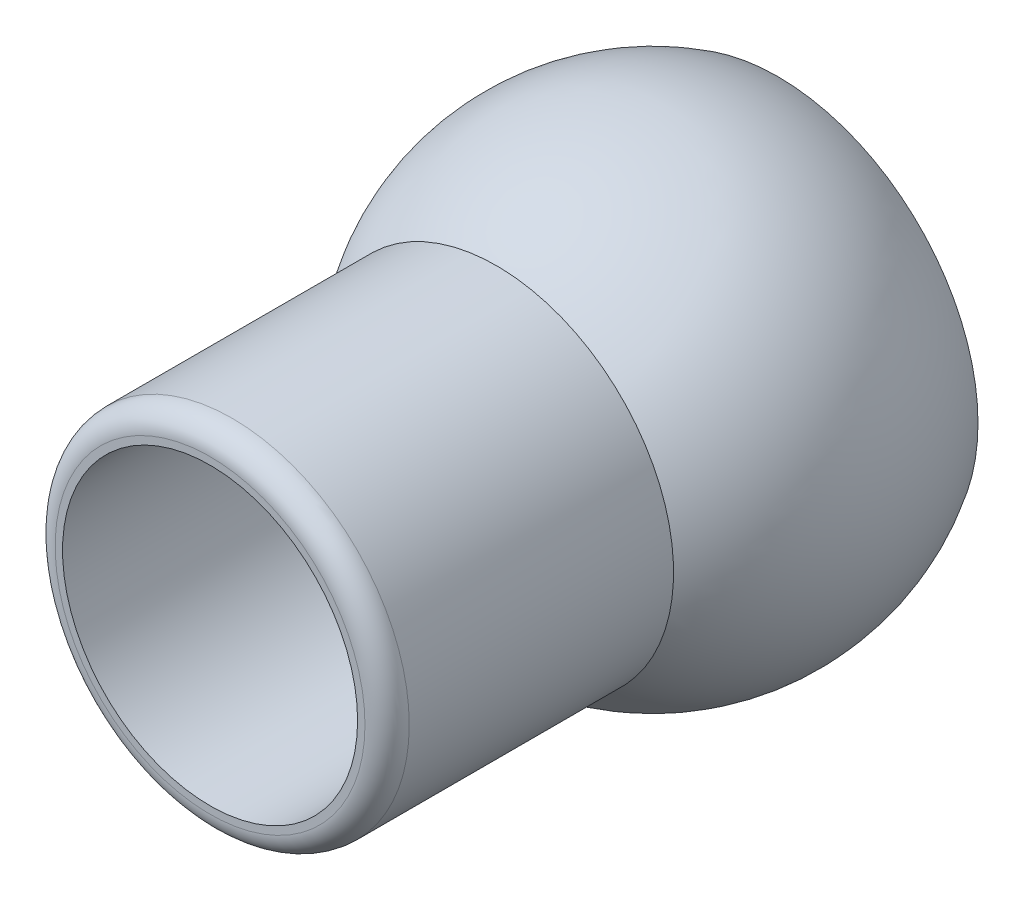
from build123d import *

# Parameters (mm, degrees)
SKETCH_3_R               = 12
EXTRUDE_2_DEPTH          = 30
CUT_EXTRUDE_2_DEPTH      = 30
CUT_EXTRUDE_2_DEPTH_BACK = 23
SKETCH_4_R               = 10
FILLET_1_R               = 1.5
CUT_EXTRUDE_3_DEPTH      = 20
CUT_EXTRUDE_3_DEPTH_BACK = 20
SKETCH_8_W               = 4
SKETCH_8_H               = 28.277196464
FILLET_2_R               = 1


with BuildPart() as part:
    # 草图1 → 旋转1 (revolve)
    with BuildSketch(Plane.XY):
        with BuildLine():
            Line((0, 16), (0, -16))
            ThreePointArc((0, -16), (16, 0), (0, 16))
        make_face()
    revolve(axis=Axis((0, 16, 0), (0, -1, 0)))

    # 草图2 → 切除-旋转1 (revolve, cut)
    with BuildSketch(Plane.XY):
        with BuildLine():
            Line((0, 14), (0, -14))
            ThreePointArc((0, -14), (14, 0), (0, 14))
        make_face()
    revolve(axis=Axis((0, 14, 0), (0, -1, 0)), mode=Mode.SUBTRACT)

    # 草图3 → 凸台-拉伸2 (add)
    with BuildSketch(Plane.XY):
        Circle(SKETCH_3_R)
    extrude(amount=EXTRUDE_2_DEPTH)

    # 草图4 → 切除-拉伸2 (cut, two sides: drawn at the far end of the back side and taken through both)
    with BuildSketch(Plane.XY.offset(-CUT_EXTRUDE_2_DEPTH_BACK)):
        Circle(SKETCH_4_R)
    extrude(amount=CUT_EXTRUDE_2_DEPTH + CUT_EXTRUDE_2_DEPTH_BACK, mode=Mode.SUBTRACT)

    # 草图6 → 切除-旋转2 (revolve, cut)
    with BuildSketch(Plane.XY):
        with BuildLine():
            Line((0, 14), (0, -14))
            ThreePointArc((0, -14), (14, 0), (0, 14))
        make_face()
    revolve(axis=Axis((0, 14, 0), (0, -1, 0)), mode=Mode.SUBTRACT)

    # 圆角1
    fillet_1_edges = [part.edges().sort_by_distance(p)[0] for p in [
        (-12, 0, 30),
    ]]
    fillet(fillet_1_edges, radius=FILLET_1_R)

    # 草图8 → 切除-拉伸3 (cut, two sides: drawn at the far end of the back side and taken through both)
    with BuildSketch(Plane(origin=(0, 0, 0), x_dir=(0, 0, -1), z_dir=(1, 0, 0)).offset(-CUT_EXTRUDE_3_DEPTH_BACK)):
        with Locations((10.489995997, 0)):
            Rectangle(SKETCH_8_W, SKETCH_8_H)
    extrude(amount=CUT_EXTRUDE_3_DEPTH + CUT_EXTRUDE_3_DEPTH_BACK, mode=Mode.SUBTRACT)

    # 圆角2
    fillet_2_edges = [part.edges().sort_by_distance(p)[0] for p in [
        (0, 11.131934602, -8.489995997),
    ]]
    fillet(fillet_2_edges, radius=FILLET_2_R)


solid = part.part
